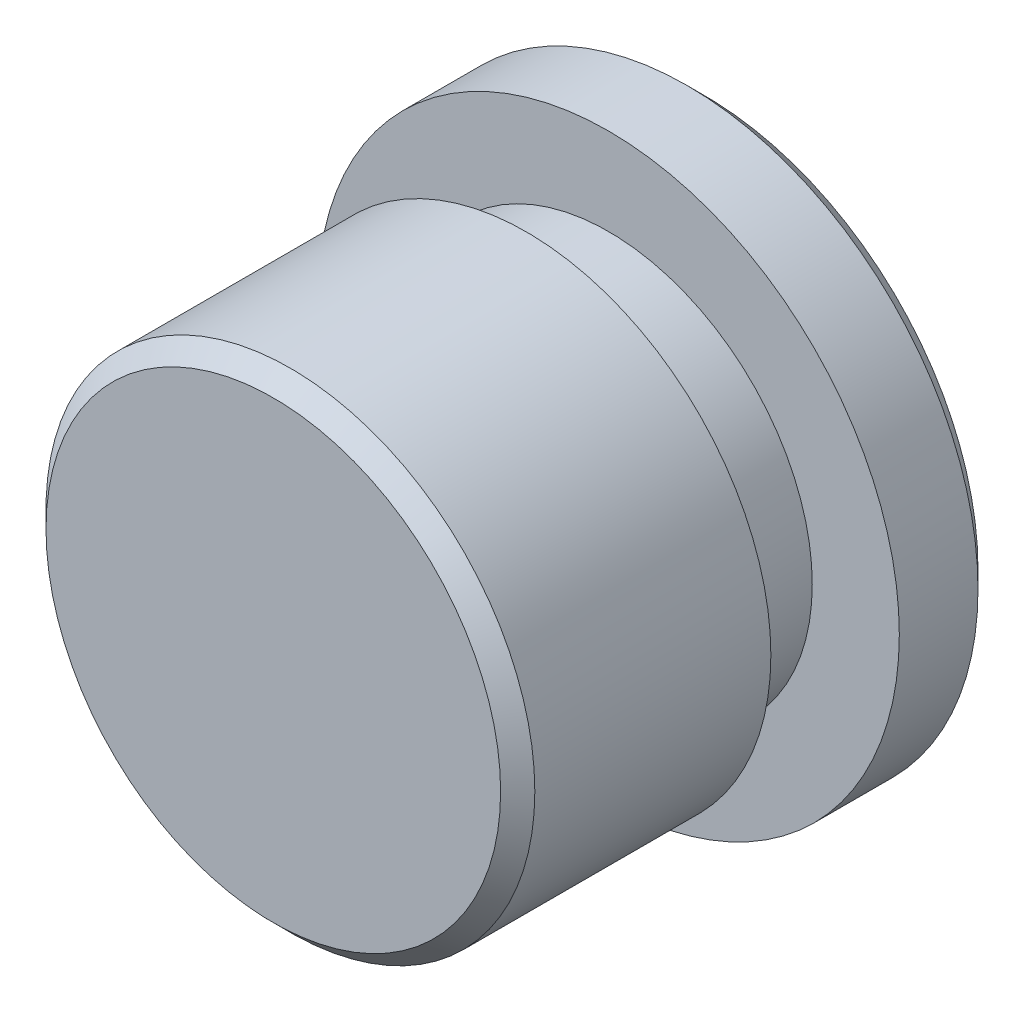
from build123d import *

# Parameters (mm, degrees)
SKETCH_1_R          = 8.5
EXTRUDE_1_DEPTH     = 2.8
SKETCH_2_R          = 5.955
EXTRUDE_2_DEPTH     = 2.4
SKETCH_3_R          = 7.145
EXTRUDE_3_DEPTH     = 7.4
CHAMFER_1_SIZE      = 0.5
CHAMFER_2_SIZE      = 0.5
CUT_EXTRUDE_1_DEPTH = 5.2
SKETCH_5_R          = 3.464101615
CUT_EXTRUDE_2_DEPTH = 0.5
CUT_EXTRUDE_2_DRAFT = -37


with BuildPart() as part:
    # 草图1 → 拉伸1 (new body)
    with BuildSketch(Plane.XY):
        Circle(SKETCH_1_R)
    extrude(amount=EXTRUDE_1_DEPTH)

    # 草图2 → 拉伸2 (add)
    with BuildSketch(Plane.XY.offset(2.8)):
        Circle(SKETCH_2_R)
    extrude(amount=EXTRUDE_2_DEPTH)

    # 草图3 → 拉伸3 (add)
    with BuildSketch(Plane.XY.offset(5.2)):
        Circle(SKETCH_3_R)
    extrude(amount=EXTRUDE_3_DEPTH)

    # 倒角1
    chamfer_1_edges = [part.edges().sort_by_distance(p)[0] for p in [
        (-7.145, 0, 12.6),
    ]]
    chamfer(chamfer_1_edges, length=CHAMFER_1_SIZE)

    # 倒角2
    chamfer_2_edges = [part.edges().sort_by_distance(p)[0] for p in [
        (-8.5, 0, 0),
    ]]
    chamfer(chamfer_2_edges, length=CHAMFER_2_SIZE)

    # 草图4 → 切除-拉伸1 (cut)
    with BuildSketch(Plane(origin=(0, 0, 0), x_dir=(-1, 0, 0), z_dir=(0, 0, -1))):
        Polygon((2.258087232, -2.626983451), (3.40407802, 0.642069181), (1.145990788, 3.269052632), (-2.258087232, 2.626983451), (-3.40407802, -0.642069181), (-1.145990788, -3.269052632), align=None)
    extrude(amount=-CUT_EXTRUDE_1_DEPTH, mode=Mode.SUBTRACT)


with BuildPart() as cut_extrude_2_tool:
    # 草图5 → 切除-拉伸2 (with draft: the straight prism first)
    with BuildSketch(Plane(origin=(0, 0, 0), x_dir=(-1, 0, 0), z_dir=(0, 0, -1))):
        Circle(SKETCH_5_R)
    extrude(amount=-CUT_EXTRUDE_2_DEPTH)
    # 切除-拉伸2: the draft: its side faces are tilted about the plane it starts from
    cut_extrude_2_sides = [cut_extrude_2_tool.faces().sort_by_distance(p)[0] for p in [
        (3.464101615, 0, 0.25),
    ]]
    draft(cut_extrude_2_sides, Plane(origin=(0, 0, 0), x_dir=(-1, 0, 0), z_dir=(0, 0, -1)), CUT_EXTRUDE_2_DRAFT)


with BuildPart() as part_1:
    add(part.part)

    # 切除-拉伸2: cut by cut_extrude_2_tool
    add(cut_extrude_2_tool.part, mode=Mode.SUBTRACT)


solid = part_1.part
